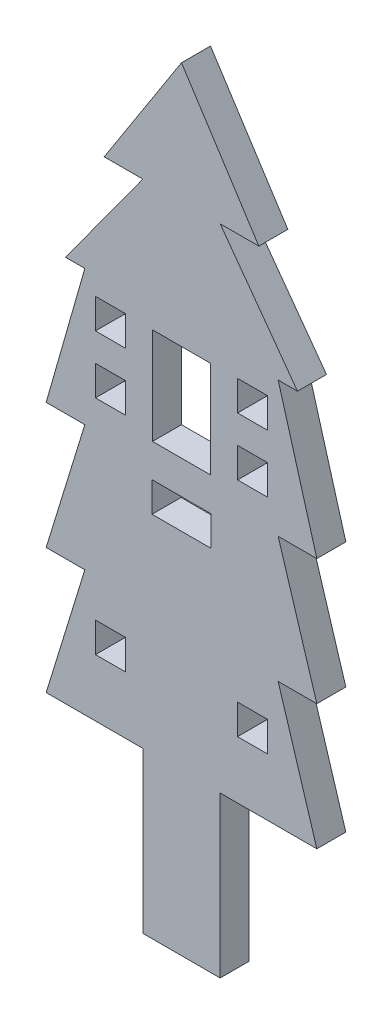
from build123d import *

# Parameters (mm, degrees)
PROFILE_LASER_PROFILE_3MM_W   = 3.1
PROFILE_LASER_PROFILE_3MM_H   = 3.1
PROFILE_LASER_PROFILE_3MM_W_2 = 6.1
PROFILE_LASER_PROFILE_3MM_W_3 = 6
PROFILE_LASER_PROFILE_3MM_H_2 = 10
LASER_PROFILE_3MM_DEPTH       = 3


with BuildPart() as part:
    # Profile_Laser_profile_3mm → Laser_profile_3mm (new body)
    with BuildSketch(Plane.XY):
        Polygon((0, 30.427227289), (8, 18), (4, 18), (12, 7), (10, 7), (14, -7), (10, -7), (14, -20), (10, -20), (14, -33), (4, -33), (4, -49.572772711), (-4, -49.572772711), (-4, -33), (-14, -33), (-10, -20), (-14, -20), (-10, -7), (-14, -7), (-10, 7), (-12, 7), (-4, 18), (-8, 18), align=None)
        with Locations((-7.35, 3.5)):
            Rectangle(PROFILE_LASER_PROFILE_3MM_W, PROFILE_LASER_PROFILE_3MM_H, mode=Mode.SUBTRACT)
        with Locations((-7.35, -2.5)):
            Rectangle(PROFILE_LASER_PROFILE_3MM_W, PROFILE_LASER_PROFILE_3MM_H, mode=Mode.SUBTRACT)
        with Locations((-7.35, -25.5)):
            Rectangle(PROFILE_LASER_PROFILE_3MM_W, PROFILE_LASER_PROFILE_3MM_H, mode=Mode.SUBTRACT)
        with Locations((7.35, 3.5)):
            Rectangle(PROFILE_LASER_PROFILE_3MM_W, PROFILE_LASER_PROFILE_3MM_H, mode=Mode.SUBTRACT)
        with Locations((7.35, -2.5)):
            Rectangle(PROFILE_LASER_PROFILE_3MM_W, PROFILE_LASER_PROFILE_3MM_H, mode=Mode.SUBTRACT)
        with Locations((7.35, -25.5)):
            Rectangle(PROFILE_LASER_PROFILE_3MM_W, PROFILE_LASER_PROFILE_3MM_H, mode=Mode.SUBTRACT)
        with Locations((0, -10)):
            Rectangle(PROFILE_LASER_PROFILE_3MM_W_2, PROFILE_LASER_PROFILE_3MM_H, mode=Mode.SUBTRACT)
        Rectangle(PROFILE_LASER_PROFILE_3MM_W_3, PROFILE_LASER_PROFILE_3MM_H_2, mode=Mode.SUBTRACT)
    extrude(amount=LASER_PROFILE_3MM_DEPTH)


solid = part.part
